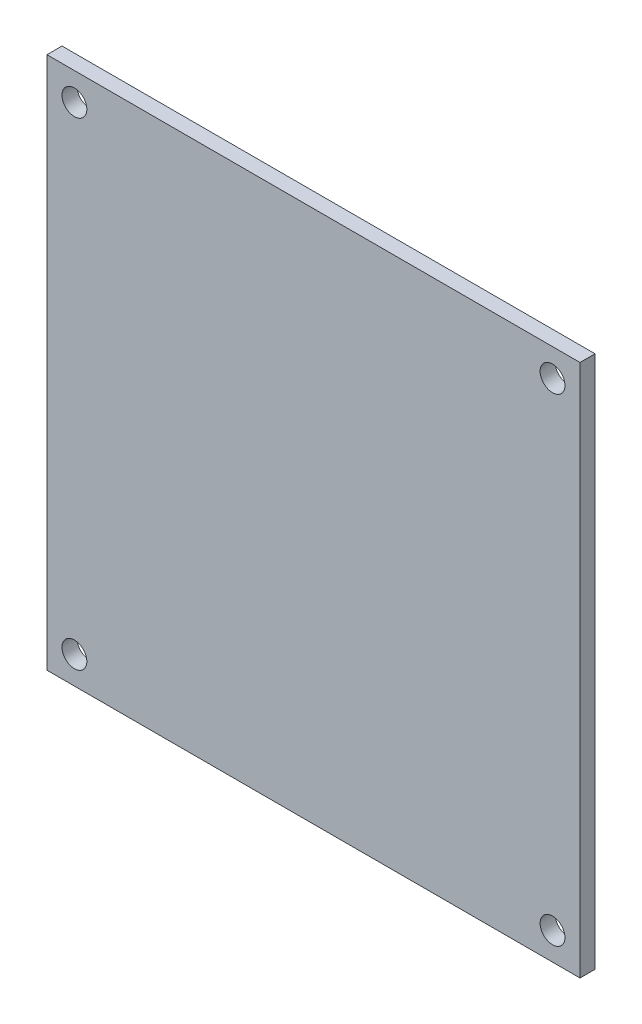
from build123d import *

# Parameters (mm, degrees)
SKETCH1_W           = 177
SKETCH1_H           = 177
SKETCH1_R           = 2.5
SKETCH1_R_2         = 4.125
BOSS_EXTRUDE1_DEPTH = 5


with BuildPart() as part:
    # Sketch1 → Boss-Extrude1 (new body)
    # profile 1 of 6: a face of its own
    with BuildSketch(Plane.XY):
        with Locations((88.5, 88.5)):
            Rectangle(SKETCH1_W, SKETCH1_H)
        with Locations((88.5, 88.5)):
            Circle(SKETCH1_R, mode=Mode.SUBTRACT)
        Polygon((163.645909278, 1.8), (159.416818556, 9.125), (163.645909278, 16.45), (172.104090722, 16.45), (176.333181444, 9.125), (172.104090722, 1.8), align=None, mode=Mode.SUBTRACT)
        Polygon((13.354090722, 1.8), (17.583181444, 9.125), (13.354090722, 16.45), (4.895909278, 16.45), (0.666818556, 9.125), (4.895909278, 1.8), align=None, mode=Mode.SUBTRACT)
        Polygon((163.645909278, 160.55), (172.104090722, 160.55), (176.333181444, 167.875), (172.104090722, 175.2), (163.645909278, 175.2), (159.416818556, 167.875), align=None, mode=Mode.SUBTRACT)
        Polygon((17.583181444, 167.875), (13.354090722, 160.55), (4.895909278, 160.55), (0.666818556, 167.875), (4.895909278, 175.2), (13.354090722, 175.2), align=None, mode=Mode.SUBTRACT)
    # profile 2 of 6: a face of its own
    with BuildSketch(Plane.XY):
        Polygon((13.354090722, 160.55), (4.895909278, 160.55), (0.666818556, 167.875), (4.895909278, 175.2), (13.354090722, 175.2), (17.583181444, 167.875), align=None)
        with Locations((9.125, 167.875)):
            Circle(SKETCH1_R_2, mode=Mode.SUBTRACT)
    # profile 3 of 6: a face of its own
    with BuildSketch(Plane.XY):
        Polygon((4.895909278, 1.8), (13.354090722, 1.8), (17.583181444, 9.125), (13.354090722, 16.45), (4.895909278, 16.45), (0.666818556, 9.125), align=None)
        with Locations((9.125, 9.125)):
            Circle(SKETCH1_R_2, mode=Mode.SUBTRACT)
    # profile 4 of 6: a face of its own
    with BuildSketch(Plane.XY):
        Polygon((159.416818556, 9.125), (163.645909278, 16.45), (172.104090722, 16.45), (176.333181444, 9.125), (172.104090722, 1.8), (163.645909278, 1.8), align=None)
        with Locations((167.875, 9.125)):
            Circle(SKETCH1_R_2, mode=Mode.SUBTRACT)
    # profile 5 of 6: a face of its own
    with BuildSketch(Plane.XY):
        Polygon((159.416818556, 167.875), (163.645909278, 160.55), (172.104090722, 160.55), (176.333181444, 167.875), (172.104090722, 175.2), (163.645909278, 175.2), align=None)
        with Locations((167.875, 167.875)):
            Circle(SKETCH1_R_2, mode=Mode.SUBTRACT)
    # profile 6 of 6: a face of its own
    with BuildSketch(Plane.XY):
        with Locations((88.5, 88.5)):
            Circle(SKETCH1_R)
    extrude(amount=BOSS_EXTRUDE1_DEPTH)


solid = part.part
